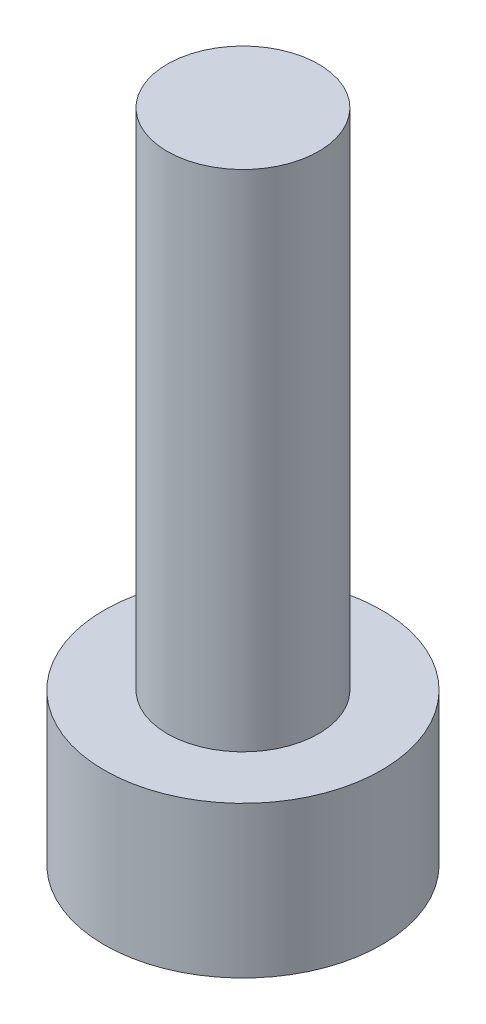
from build123d import *

# Parameters (mm, degrees)
CUT_EXTRUDE_1_DEPTH = 1.5


with BuildPart() as part:
    # 草图1 → 旋转1 (revolve)
    with BuildSketch(Plane.XY, mode=Mode.PRIVATE) as revolve_1_sk:
        Polygon((0, 0), (2.75, 0), (2.75, 3), (1.5, 3), (1.5, 13), (0, 13), align=None)
    revolve(revolve_1_sk.sketch.rotate(Axis((0, 5.079324982, 0), (0, -1, 0)), 90), axis=Axis((0, 5.079324982, 0), (0, -1, 0)))

    # 草图2 → 切除-拉伸1 (cut)
    with BuildSketch(Plane.XZ):
        Polygon((0, -1.375), (1.19078493, -0.6875), (1.19078493, 0.6875), (0, 1.375), (-1.19078493, 0.6875), (-1.19078493, -0.6875), align=None)
    extrude(amount=-CUT_EXTRUDE_1_DEPTH, mode=Mode.SUBTRACT)


solid = part.part
